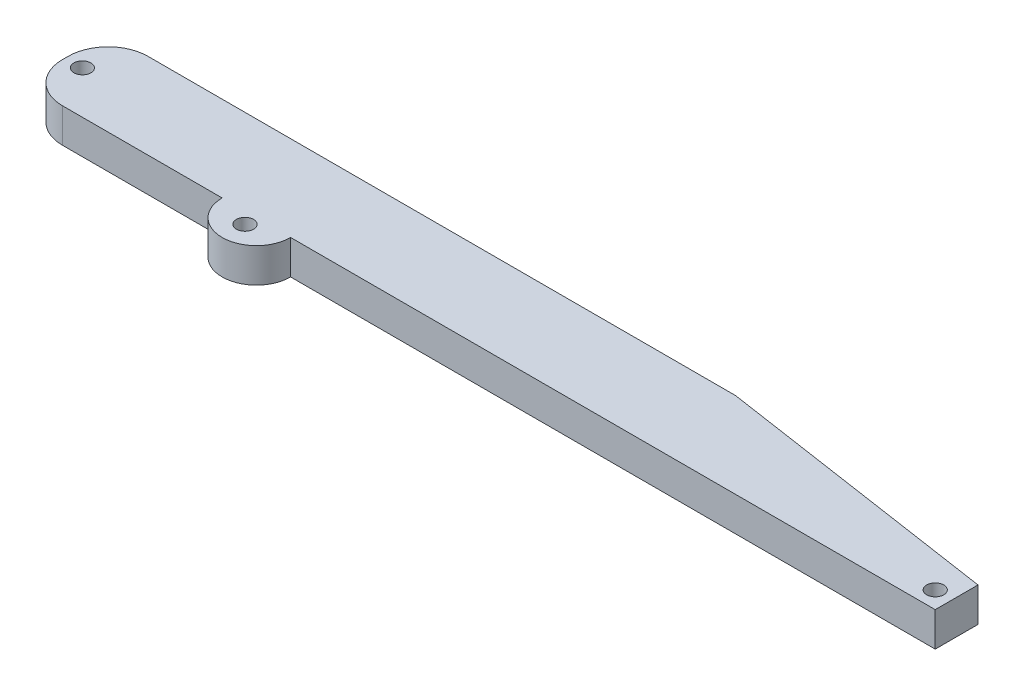
from build123d import *

# Parameters (mm, degrees)
SKETCH2_W           = 160
SKETCH2_H           = 15
BOSS_EXTRUDE1_DEPTH = 6
BOSS_EXTRUDE2_DEPTH = 6
SKETCH5_R           = 1.5
CUT_EXTRUDE1_DEPTH  = 82.352627493
CUT_EXTRUDE2_DEPTH  = 82.352627493
FILLET1_R           = 7


with BuildPart() as part:
    # Sketch2 → Boss-Extrude1 (new body)
    with BuildSketch(Plane(origin=(0, 0, 0), x_dir=(1, 0, 0), z_dir=(0, 1, 0))):
        Rectangle(SKETCH2_W, SKETCH2_H)
    extrude(amount=BOSS_EXTRUDE1_DEPTH)

    # Sketch4 → Boss-Extrude2 (add)
    with BuildSketch(Plane(origin=(0, 0, 0), x_dir=(1, 0, 0), z_dir=(0, 1, 0))):
        with BuildLine():
            Line((-45, -7.5), (-33, -7.5))
            ThreePointArc((-33, -7.5), (-39, -13.5), (-45, -7.5))
        make_face()
    extrude(amount=BOSS_EXTRUDE2_DEPTH)

    # Sketch5 → Cut-Extrude1 (cut, through all)
    with BuildSketch(Plane(origin=(0, 6, 0), x_dir=(1, 0, 0), z_dir=(0, 1, 0))):
        with Locations(Location((-77, 0, 0), (0, 0, 270))):
            Circle(SKETCH5_R)
        with Locations(Location((-39, -9.5, 0), (0, 0, 270))):
            Circle(SKETCH5_R)
        with Locations(Location((77, -4.5, 0), (0, 0, 270))):
            Circle(SKETCH5_R)
    extrude(amount=-CUT_EXTRUDE1_DEPTH, mode=Mode.SUBTRACT)

    # Sketch6 → Cut-Extrude2 (cut, through all)
    with BuildSketch(Plane(origin=(0, 6, 0), x_dir=(1, 0, 0), z_dir=(0, 1, 0))):
        Polygon((80, 0), (80, 7.5), (30, 7.5), align=None)
    extrude(amount=-CUT_EXTRUDE2_DEPTH, mode=Mode.SUBTRACT)

    # Fillet1
    fillet1_edges = [part.edges().sort_by_distance(p)[0] for p in [
        (-80, 3, -7.5),
        (-80, 3, 7.5),
    ]]
    fillet(fillet1_edges, radius=FILLET1_R)


solid = part.part
